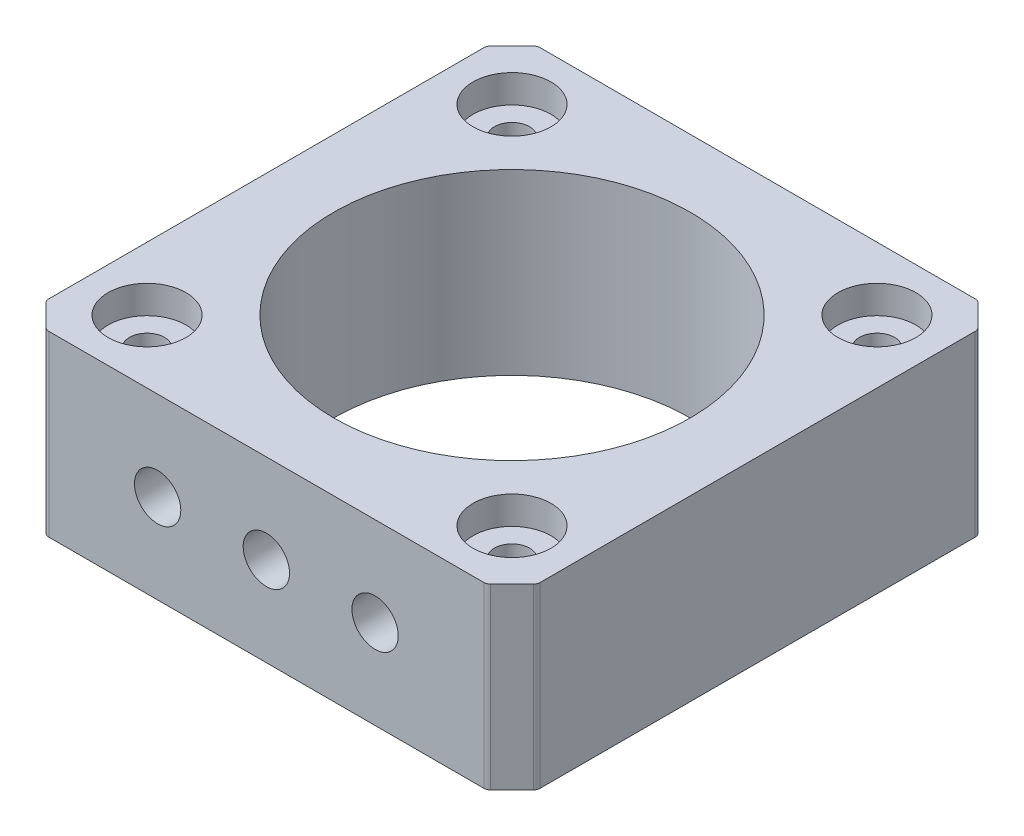
from build123d import *

# Parameters (mm, degrees)
SKETCH1_R           = 12.7
SKETCH1_R_2         = 1.65
BOSS_EXTRUDE1_DEPTH = 12.7
SKETCH2_R           = 1.65
CUT_EXTRUDE1_DEPTH  = 12.7
SKETCH3_R           = 2.77495
CUT_EXTRUDE3_DEPTH  = 1.99898
SKETCH7_R           = 1.65
BOSS_EXTRUDE2_DEPTH = 10.70102
SKETCH8_R           = 1.65
BOSS_EXTRUDE3_DEPTH = 10.70102
SKETCH9_R           = 1.65
BOSS_EXTRUDE4_DEPTH = 10.70102
SKETCH10_R          = 1.65
BOSS_EXTRUDE5_DEPTH = 10.70102
SKETCH12_R          = 1.25
CUT_EXTRUDE4_DEPTH  = 12.7
SKETCH11_R          = 1.25
CUT_EXTRUDE5_DEPTH  = 12.7


with BuildPart() as part:
    # Sketch1 → Boss-Extrude1 (new body)
    with BuildSketch(Plane(origin=(0, 0, 0), x_dir=(1, 0, 0), z_dir=(0, 1, 0))):
        with BuildLine():
            Line((21.686311219, 59.206008809), (23.227161891, 57.665158137))
            ThreePointArc((23.227161891, 57.665158137), (23.323849078, 57.508955756), (23.357596674, 57.328376976))
            Line((23.357596674, 57.328376976), (23.357596674, 26.344510207))
            ThreePointArc((23.357596674, 26.344510207), (23.323849078, 26.163931427), (23.227161891, 26.007729046))
            Line((23.227161891, 26.007729046), (21.686311219, 24.466878374))
            ThreePointArc((21.686311219, 24.466878374), (21.530108838, 24.370191187), (21.349530059, 24.336443591))
            Line((21.349530059, 24.336443591), (-9.634336711, 24.336443591))
            ThreePointArc((-9.634336711, 24.336443591), (-9.814915491, 24.370191187), (-9.971117871, 24.466878374))
            Line((-9.971117871, 24.466878374), (-11.511968543, 26.007729046))
            ThreePointArc((-11.511968543, 26.007729046), (-11.60865573, 26.163931427), (-11.642403326, 26.344510207))
            Line((-11.642403326, 26.344510207), (-11.642403326, 57.328376976))
            ThreePointArc((-11.642403326, 57.328376976), (-11.60865573, 57.508955756), (-11.511968543, 57.665158137))
            Line((-11.511968543, 57.665158137), (-9.971117871, 59.206008809))
            ThreePointArc((-9.971117871, 59.206008809), (-9.814915491, 59.302695995), (-9.634336711, 59.336443591))
            Line((-9.634336711, 59.336443591), (21.349530059, 59.336443591))
            ThreePointArc((21.349530059, 59.336443591), (21.530108838, 59.302695995), (21.686311219, 59.206008809))
        make_face()
        with Locations(Location((5.857596674, 41.836443591, 0), (0, 0, 90))):
            Circle(SKETCH1_R, mode=Mode.SUBTRACT)
        with Locations(Location((18.857596674, 54.836443591, 0), (0, 0, 90))):
            Circle(SKETCH1_R_2, mode=Mode.SUBTRACT)
        with Locations(Location((18.857596674, 28.836443591, 0), (0, 0, 90))):
            Circle(SKETCH1_R_2, mode=Mode.SUBTRACT)
        with Locations(Location((-7.142403326, 54.836443591, 0), (0, 0, 90))):
            Circle(SKETCH1_R_2, mode=Mode.SUBTRACT)
        with Locations(Location((-7.142403326, 28.836443591, 0), (0, 0, 90))):
            Circle(SKETCH1_R_2, mode=Mode.SUBTRACT)
    extrude(amount=BOSS_EXTRUDE1_DEPTH)

    # Sketch2 → Cut-Extrude1 (cut)
    with BuildSketch(Plane.XY.offset(-24.336443591)):
        with Locations((-1.888370018, 6.35)):
            Circle(SKETCH2_R)
        with Locations((13.603563366, 6.35)):
            Circle(SKETCH2_R)
        with Locations((5.857596674, 6.35)):
            Circle(SKETCH2_R)
    extrude(amount=-CUT_EXTRUDE1_DEPTH, mode=Mode.SUBTRACT)

    # Sketch3 → Cut-Extrude3 (cut)
    with BuildSketch(Plane(origin=(0, 12.7, 0), x_dir=(1, 0, 0), z_dir=(0, 1, 0))):
        with Locations(Location((-7.142403326, 54.836443591, 0), (0, 0, 270))):
            Circle(SKETCH3_R)
        with Locations(Location((18.857596674, 54.836443591, 0), (0, 0, 270))):
            Circle(SKETCH3_R)
        with Locations(Location((-7.142403326, 28.836443591, 0), (0, 0, 270))):
            Circle(SKETCH3_R)
        with Locations(Location((18.857596674, 28.836443591, 0), (0, 0, 270))):
            Circle(SKETCH3_R)
    extrude(amount=-CUT_EXTRUDE3_DEPTH, mode=Mode.SUBTRACT)

    # Sketch7 → Boss-Extrude2 (add, through all)
    with BuildSketch(Plane(origin=(0, 10.70102, 0), x_dir=(1, 0, 0), z_dir=(0, 1, 0))):
        with Locations((-7.142403326, 28.836443591)):
            Circle(SKETCH7_R)
    extrude(amount=-BOSS_EXTRUDE2_DEPTH)

    # Sketch8 → Boss-Extrude3 (add, through all)
    with BuildSketch(Plane(origin=(0, 10.70102, 0), x_dir=(1, 0, 0), z_dir=(0, 1, 0))):
        with Locations((-7.142403326, 54.836443591)):
            Circle(SKETCH8_R)
    extrude(amount=-BOSS_EXTRUDE3_DEPTH)

    # Sketch9 → Boss-Extrude4 (add, through all)
    with BuildSketch(Plane(origin=(0, 10.70102, 0), x_dir=(1, 0, 0), z_dir=(0, 1, 0))):
        with Locations((18.857596674, 54.836443591)):
            Circle(SKETCH9_R)
    extrude(amount=-BOSS_EXTRUDE4_DEPTH)

    # Sketch10 → Boss-Extrude5 (add, through all)
    with BuildSketch(Plane(origin=(0, 10.70102, 0), x_dir=(1, 0, 0), z_dir=(0, 1, 0))):
        with Locations((18.857596674, 28.836443591)):
            Circle(SKETCH10_R)
    extrude(amount=-BOSS_EXTRUDE5_DEPTH)

    # Sketch12 → Cut-Extrude4 (cut)
    with BuildSketch(Plane(origin=(0, 10.70102, 0), x_dir=(1, 0, 0), z_dir=(0, 1, 0))):
        with Locations(Location((18.857596674, 54.836443591, 0), (0, 0, 270))):
            Circle(SKETCH12_R)
        with Locations(Location((-7.142403326, 28.836443591, 0), (0, 0, 270))):
            Circle(SKETCH12_R)
        with Locations(Location((18.857596674, 28.836443591, 0), (0, 0, 270))):
            Circle(SKETCH12_R)
    extrude(amount=-CUT_EXTRUDE4_DEPTH, mode=Mode.SUBTRACT)

    # Sketch11 → Cut-Extrude5 (cut)
    with BuildSketch(Plane(origin=(0, 10.70102, 0), x_dir=(1, 0, 0), z_dir=(0, 1, 0))):
        with Locations(Location((-7.142403326, 54.836443591, 0), (0, 0, 270))):
            Circle(SKETCH11_R)
    extrude(amount=-CUT_EXTRUDE5_DEPTH, mode=Mode.SUBTRACT)


solid = part.part
